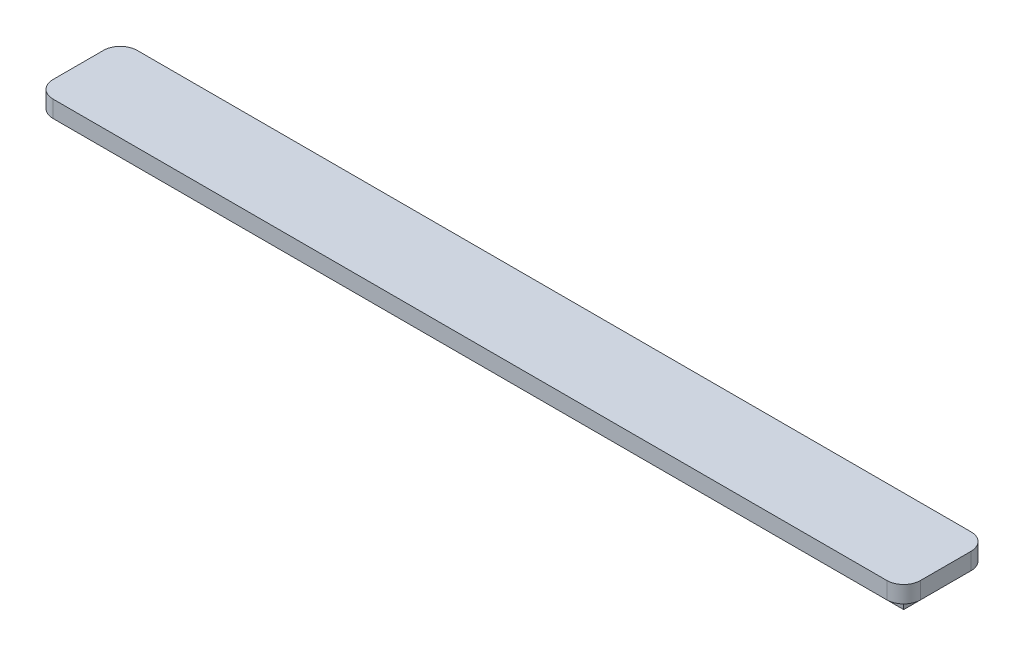
from build123d import *

# Parameters (mm, degrees)
SKETCH1_W           = 99
SKETCH1_H           = 6
BOSS_EXTRUDE1_DEPTH = 2
SKETCH2_W           = 101
SKETCH2_H           = 8
BOSS_EXTRUDE3_DEPTH = 2
DRAFT1_ANGLE        = 10
SKETCH3_W           = 103
SKETCH3_H           = 10
BOSS_EXTRUDE4_DEPTH = 2
FILLET1_R           = 2


with BuildPart() as part:
    # Sketch1 → Boss-Extrude1 (new body)
    with BuildSketch(Plane(origin=(0, 0, 0), x_dir=(1, 0, 0), z_dir=(0, 1, 0))):
        Rectangle(SKETCH1_W, SKETCH1_H)
    extrude(amount=BOSS_EXTRUDE1_DEPTH)

    # Draft1
    draft1_faces = [part.faces().sort_by_distance(p)[0] for p in [
        (49.5, 1, 0),
        (0, 1, 3),
        (-49.5, 1, 0),
        (0, 1, -3),
    ]]
    draft(draft1_faces, Plane(origin=(0, 0, 0), x_dir=(0, 0, -1), z_dir=(0, -1, 0)), DRAFT1_ANGLE)



with BuildPart() as body_2:
    # Sketch2 → Boss-Extrude3 (new body)
    with BuildSketch(Plane(origin=(0, 2, 0), x_dir=(1, 0, 0), z_dir=(0, 1, 0))):
        Rectangle(SKETCH2_W, SKETCH2_H)
    extrude(amount=BOSS_EXTRUDE3_DEPTH)


with BuildPart() as part_1:
    add(part.part)

    add(body_2.part)  # Boss-Extrude4 merges body 2
    # Sketch3 → Boss-Extrude4 (add)
    with BuildSketch(Plane(origin=(0, 4, 0), x_dir=(1, 0, 0), z_dir=(0, 1, 0))):
        Rectangle(SKETCH3_W, SKETCH3_H)
    extrude(amount=-BOSS_EXTRUDE4_DEPTH)

    # Fillet1
    fillet1_edges = [part_1.edges().sort_by_distance(p)[0] for p in [
        (-51.5, 3, 5),
        (-51.5, 3, -5),
        (51.5, 3, -5),
        (51.5, 3, 5),
    ]]
    fillet(fillet1_edges, radius=FILLET1_R)


solid = part_1.part
